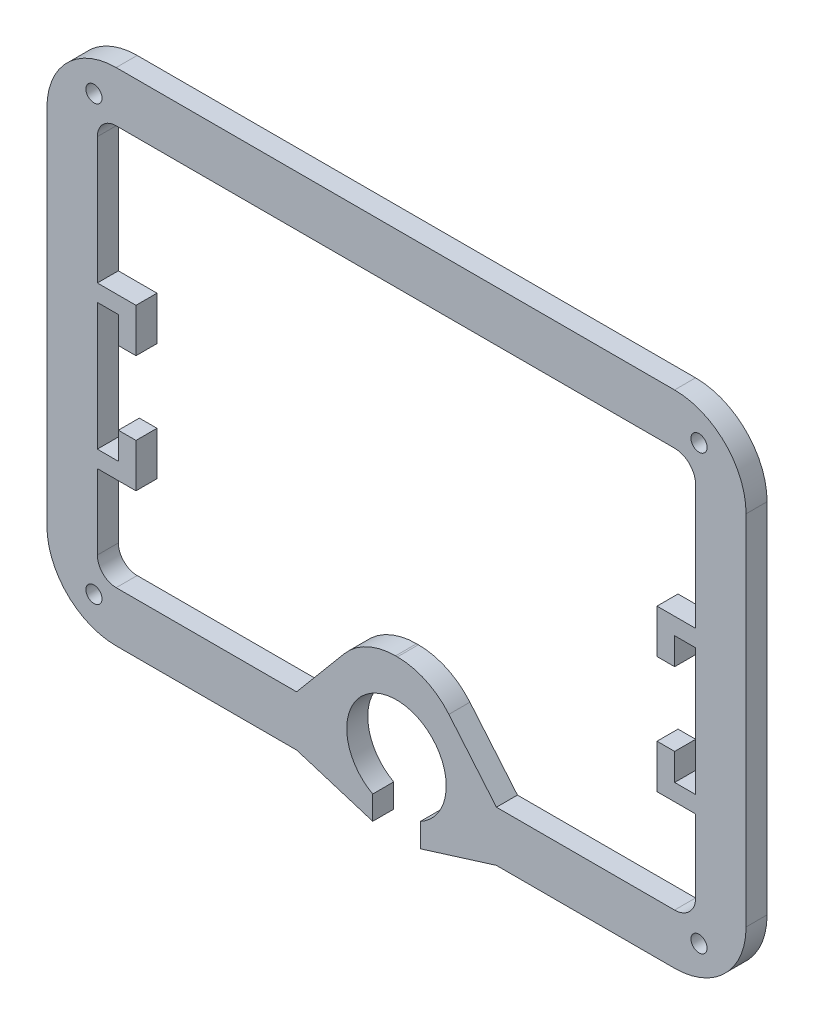
from build123d import *

# Parameters (mm, degrees)
SKETCH1_R           = 0.6096
BOSS_EXTRUDE1_DEPTH = 1.5875
SKETCH2_W           = 1.5875
SKETCH2_H           = 1.27
BOSS_EXTRUDE2_DEPTH = 2.921
CUT_EXTRUDE1_DEPTH  = 1.5875
SKETCH3_W           = 1.5875
SKETCH3_H           = 5.540367605
CUT_EXTRUDE2_DEPTH  = 1.3335


with BuildPart() as part:
    # Sketch1 → Boss-Extrude1 (new body)
    with BuildSketch(Plane.XY):
        with BuildLine():
            Line((-21.183334762, -18.923), (-7.542517063, -18.923))
            Line((-7.542517063, -18.923), (-1.796769501, -20.710658693))
            Line((-1.796769501, -20.710658693), (-1.796769501, -18.923))
            ThreePointArc((-1.796769501, -18.923), (0, -11.8618), (1.796769501, -18.923))
            Line((1.796769501, -18.923), (1.796769501, -20.710658693))
            Line((1.796769501, -20.710658693), (7.542517063, -18.923))
            Line((7.542517063, -18.923), (21.011390278, -18.923))
            ThreePointArc((21.011390278, -18.923), (24.833026462, -17.340026462), (26.416, -13.518390278))
            Line((26.416, -13.518390278), (26.416, 13.518390278))
            ThreePointArc((26.416, 13.518390278), (24.833026462, 17.340026462), (21.011390278, 18.923))
            Line((21.011390278, 18.923), (-21.183334762, 18.923))
            ThreePointArc((-21.183334762, 18.923), (-24.883387836, 17.390387836), (-26.416, 13.690334762))
            Line((-26.416, 13.690334762), (-26.416, -13.690334762))
            ThreePointArc((-26.416, -13.690334762), (-24.883387836, -17.390387836), (-21.183334762, -18.923))
        make_face()
        with Locations((-22.86, 16.383)):
            Circle(SKETCH1_R, mode=Mode.SUBTRACT)
        with Locations(Location((22.86, 16.383, 0), (0, 0, 180))):
            Circle(SKETCH1_R, mode=Mode.SUBTRACT)
        with Locations((22.86, -16.383)):
            Circle(SKETCH1_R, mode=Mode.SUBTRACT)
        with Locations(Location((-22.86, -16.383, 0), (0, 0, 180))):
            Circle(SKETCH1_R, mode=Mode.SUBTRACT)
        with BuildLine():
            Line((-22.606, 13.690334762), (-22.606, -13.690334762))
            ThreePointArc((-22.606, -13.690334762), (-22.189310999, -14.696310999), (-21.183334762, -15.113))
            Line((-21.183334762, -15.113), (-7.552133781, -15.113))
            Line((-7.552133781, -15.113), (-3.959645297, -10.831638943))
            ThreePointArc((-3.959645297, -10.831638943), (-2.215040295, -9.492956442), (-0.068139526, -9.017))
            Line((-0.068139526, -9.017), (0.068139526, -9.017))
            ThreePointArc((0.068139526, -9.017), (2.215040295, -9.492956442), (3.959645297, -10.831638943))
            Line((3.959645297, -10.831638943), (7.552133781, -15.113))
            Line((7.552133781, -15.113), (21.011390278, -15.113))
            ThreePointArc((21.011390278, -15.113), (22.138949626, -14.645949626), (22.606, -13.518390278))
            Line((22.606, -13.518390278), (22.606, 13.518390278))
            ThreePointArc((22.606, 13.518390278), (22.138949626, 14.645949626), (21.011390278, 15.113))
            Line((21.011390278, 15.113), (-21.183334762, 15.113))
            ThreePointArc((-21.183334762, 15.113), (-22.189310999, 14.696310999), (-22.606, 13.690334762))
        make_face(mode=Mode.SUBTRACT)
    extrude(amount=BOSS_EXTRUDE1_DEPTH)

    # Sketch2 → Boss-Extrude2 (add)
    with BuildSketch(Plane(origin=(-22.606, 0, 0), x_dir=(0, 0, -1), z_dir=(1, 0, 0))):
        with Locations((-0.79375, 3.4798)):
            Rectangle(SKETCH2_W, SKETCH2_H)
        Polygon((0, 1.469264578), (0, 2.8448), (-1.5875, 2.8448), (-1.5875, -6.644691549), (-1.5875, -6.759567605), (0, -6.759567605), align=None)
        Polygon((0, -7.914691549), (0, -6.759567605), (-1.5875, -6.759567605), (-1.5875, -7.914691549), (-1.5875, -8.029567605), (0, -8.029567605), align=None)
    boss_extrude2 = extrude(amount=BOSS_EXTRUDE2_DEPTH)

    # Sketch2<3> → Cut-Extrude1 (cut)
    with BuildSketch(Plane(origin=(-22.606, 0, 0), x_dir=(0, 0, -1), z_dir=(1, 0, 0))):
        Polygon((0, 1.469264578), (0, 2.8448), (-1.5875, 2.8448), (-1.5875, -6.644691549), (-1.5875, -6.759567605), (0, -6.759567605), align=None)
    cut_extrude1 = extrude(amount=CUT_EXTRUDE1_DEPTH, mode=Mode.SUBTRACT)

    # Sketch3 → Cut-Extrude2 (cut)
    with BuildSketch(Plane.ZY.offset(21.0185)):
        with Locations((0.79375, -1.957383802)):
            Rectangle(SKETCH3_W, SKETCH3_H)
    cut_extrude2 = extrude(amount=-CUT_EXTRUDE2_DEPTH, mode=Mode.SUBTRACT)

    # Mirror1: Boss-Extrude2, Cut-Extrude1, Cut-Extrude2 across plane
    add(boss_extrude2.mirror(Plane(origin=(0, 0, 0), x_dir=(0, 0, 1), z_dir=(1, 0, 0))))
    add(cut_extrude1.mirror(Plane(origin=(0, 0, 0), x_dir=(0, 0, 1), z_dir=(1, 0, 0))), mode=Mode.SUBTRACT)
    add(cut_extrude2.mirror(Plane(origin=(0, 0, 0), x_dir=(0, 0, 1), z_dir=(1, 0, 0))), mode=Mode.SUBTRACT)


solid = part.part
